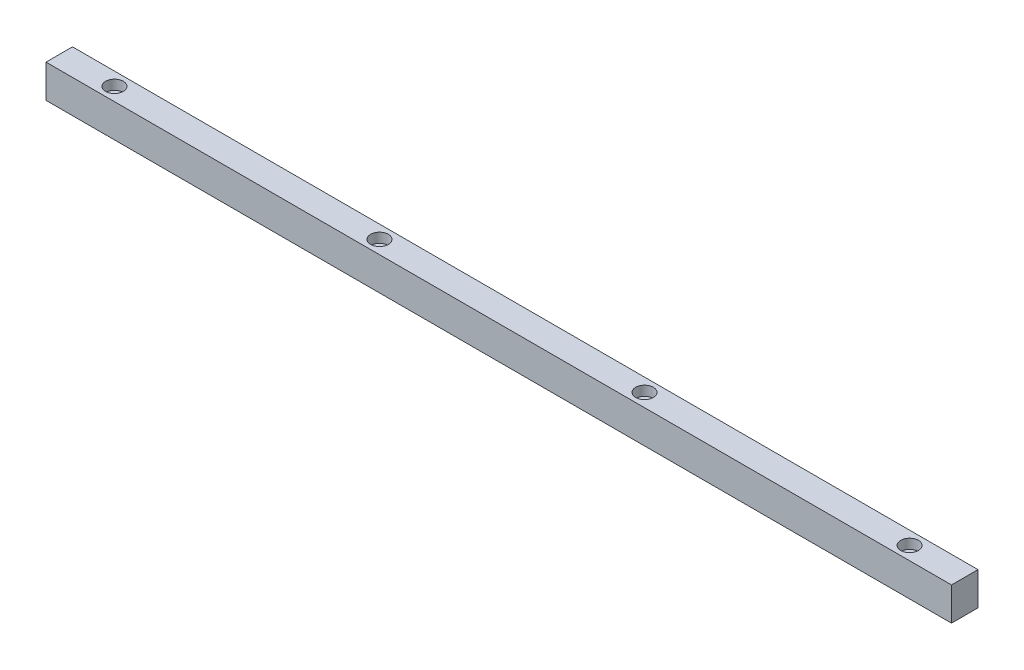
from build123d import *

# Parameters (mm, degrees)
SKETCH_1_W                   = 410
SKETCH_1_H                   = 12
EXTRUDE_1_DEPTH              = 15
HOLE_WIZARD_M4_1_D           = 4.5
HOLE_WIZARD_M4_1_CBORE_D     = 8
HOLE_WIZARD_M4_1_CBORE_DEPTH = 4.4


with BuildPart() as part:
    # 草图1 → 凸台-拉伸1 (new body)
    with BuildSketch(Plane(origin=(0, 0, 0), x_dir=(1, 0, 0), z_dir=(0, 1, 0))):
        Rectangle(SKETCH_1_W, SKETCH_1_H)
    extrude(amount=EXTRUDE_1_DEPTH)

    # M4 六角凹头螺钉的柱形沉头孔1 (through all)
    with Locations(Plane(origin=(0, 15, 0), x_dir=(1, 0, 0), z_dir=(0, 1, 0))):
        with Locations((60, 0), (-60, 0), (-180, 0), (180, 0)):
            CounterBoreHole(HOLE_WIZARD_M4_1_D / 2, HOLE_WIZARD_M4_1_CBORE_D / 2, HOLE_WIZARD_M4_1_CBORE_DEPTH)


solid = part.part
